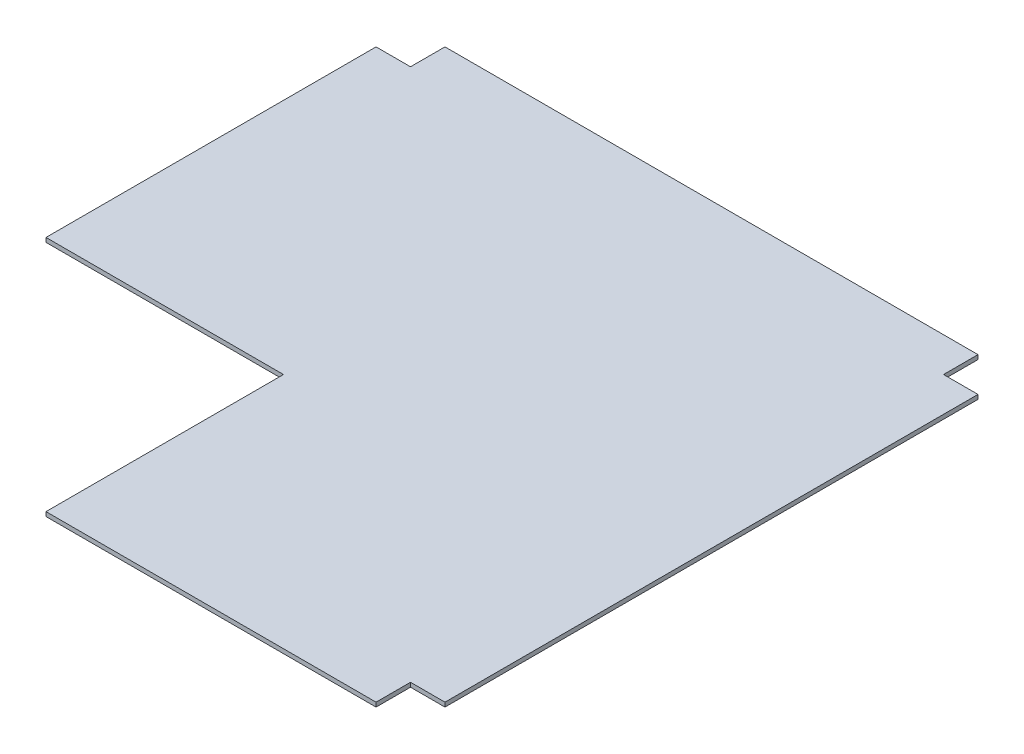
from build123d import *

# Parameters (mm, degrees)
BOSS_EXTRUDE1_DEPTH = 3.175


with BuildPart() as part:
    # Sketch1 → Boss-Extrude1 (new body)
    with BuildSketch(Plane(origin=(0, 0, 0), x_dir=(1, 0, 0), z_dir=(0, 1, 0))):
        Polygon((175, 175), (175, 0), (418.25, 0), (418.25, 25.4), (443.65, 25.4), (443.65, 418.25), (418.25, 418.25), (418.25, 443.65), (25.4, 443.65), (25.4, 418.25), (0, 418.25), (0, 175), align=None)
    extrude(amount=BOSS_EXTRUDE1_DEPTH)


solid = part.part
